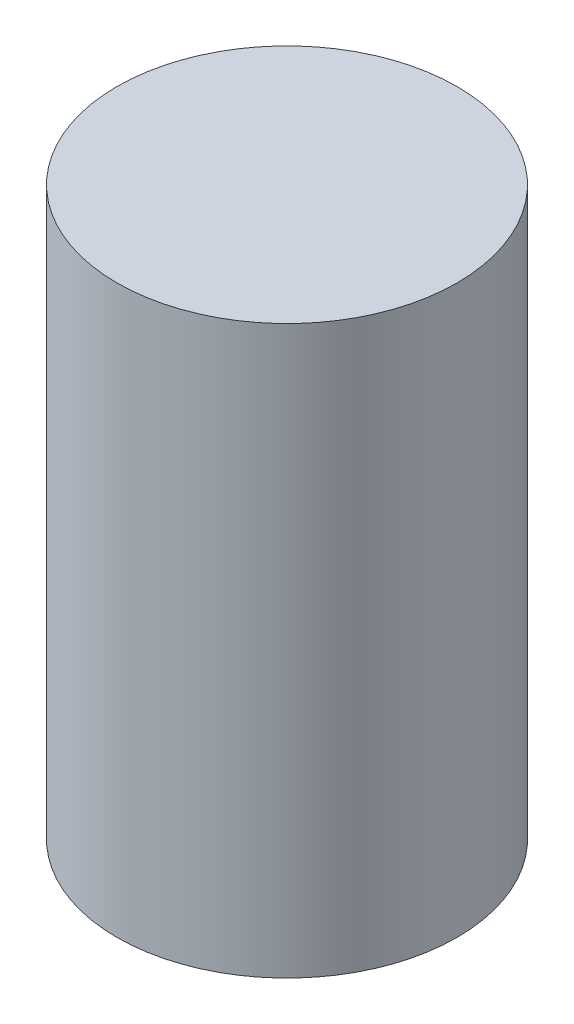
from build123d import *

# Parameters (mm, degrees)
SKETCH_1_R      = 300
EXTRUDE_1_DEPTH = 1000


with BuildPart() as part:
    # 草图1 → 凸台-拉伸1 (new body)
    with BuildSketch(Plane(origin=(0, 0, 0), x_dir=(1, 0, 0), z_dir=(0, 1, 0))):
        with Locations(Location((0, 0, 0), (0, 0, 270))):
            Circle(SKETCH_1_R)
    extrude(amount=EXTRUDE_1_DEPTH)


solid = part.part
